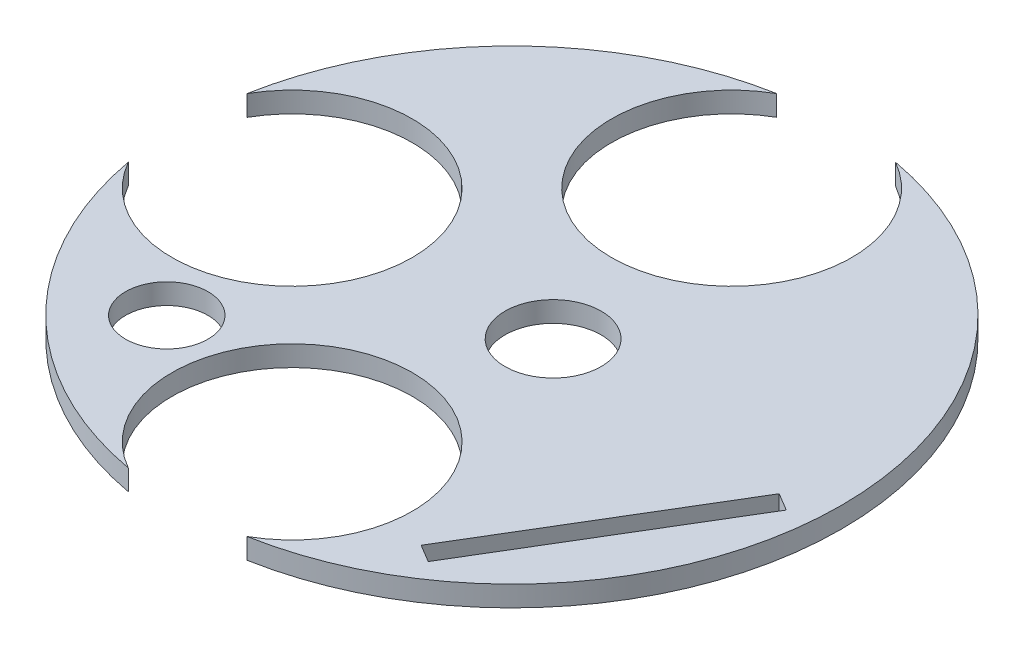
from build123d import *

# Parameters (mm, degrees)
ESQUISSE1_R        = 3
ESQUISSE1_R_2      = 3.5
BOSS_EXTRU_1_DEPTH = 1.5


with BuildPart() as part:
    # Esquisse1 → Boss.-Extru.1 (new body)
    with BuildSketch(Plane(origin=(0, 0, 0), x_dir=(1, 0, 0), z_dir=(0, 1, 0))):
        with BuildLine():
            ThreePointArc((4.323150751, -23.607421875), (18.435775248, -15.366267959), (24, 0))
            ThreePointArc((24, 0), (18.435775248, 15.366267959), (4.323150751, 23.607421875))
            ThreePointArc((4.323150751, 23.607421875), (7.562739883, 20.400848266), (8.75, 16))
            ThreePointArc((8.75, 16), (-4.400848266, 8.437260117), (-4.323150751, 23.607421875))
            ThreePointArc((-4.323150751, 23.607421875), (-16.970562748, 16.970562748), (-23.607421875, 4.323150751))
            ThreePointArc((-23.607421875, 4.323150751), (-13.764204997, 8.459534308), (-7.25, 0))
            ThreePointArc((-7.25, 0), (-13.764204997, -8.459534308), (-23.607421875, -4.323150751))
            ThreePointArc((-23.607421875, -4.323150751), (-16.970562748, -16.970562748), (-4.323150751, -23.607421875))
            ThreePointArc((-4.323150751, -23.607421875), (-4.400848266, -8.437260117), (8.75, -16))
            ThreePointArc((8.75, -16), (7.562739883, -20.400848266), (4.323150751, -23.607421875))
        make_face()
        with Locations(Location((-12.542919229, -12.586407821, 0), (0, 0, 270))):
            Circle(ESQUISSE1_R, mode=Mode.SUBTRACT)
        Polygon((11.214276577, -17.821234439), (21, -1.535055726), (22.285750951, -2.307612838), (12.500027528, -18.593791552), align=None, mode=Mode.SUBTRACT)
        with Locations(Location((3, 0, 0), (0, 0, 270))):
            Circle(ESQUISSE1_R_2, mode=Mode.SUBTRACT)
    extrude(amount=BOSS_EXTRU_1_DEPTH)


solid = part.part
